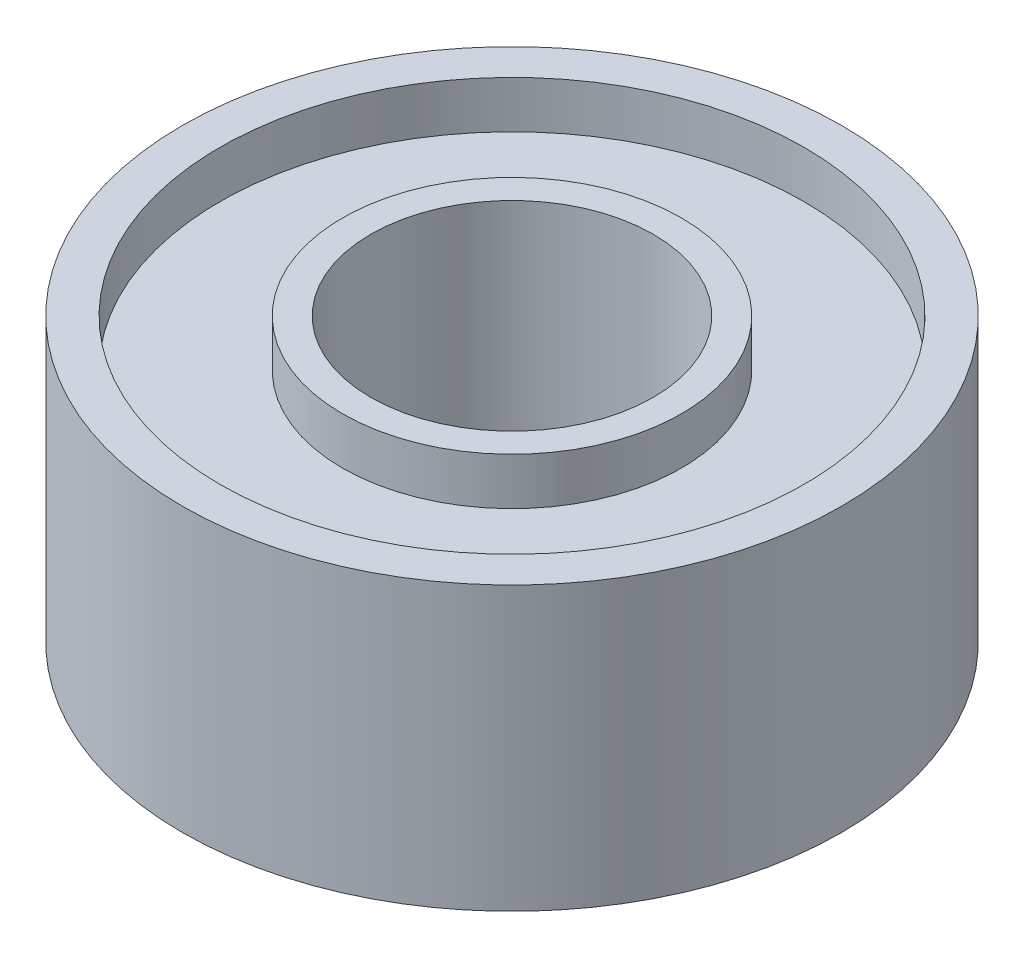
from build123d import *

# Parameters (mm, degrees)
SKETCH_1_R          = 3.5
SKETCH_1_R_2        = 1.5
EXTRUDE_1_DEPTH     = 3
SKETCH_2_R          = 3.1
SKETCH_2_R_2        = 1.8
CUT_EXTRUDE_1_DEPTH = 0.5


with BuildPart() as part:
    # 草图1 → 凸台-拉伸1 (new body)
    with BuildSketch(Plane(origin=(0, 0, 0), x_dir=(1, 0, 0), z_dir=(0, 1, 0))):
        with Locations(Location((0, 0, 0), (0, 0, 270))):
            Circle(SKETCH_1_R)
        with Locations(Location((0, 0, 0), (0, 0, 270))):
            Circle(SKETCH_1_R_2, mode=Mode.SUBTRACT)
    extrude(amount=EXTRUDE_1_DEPTH)

    # 草图2 → 切除-拉伸1 (cut)
    with BuildSketch(Plane(origin=(0, 3, 0), x_dir=(1, 0, 0), z_dir=(0, 1, 0))):
        with Locations(Location((0, 0, 0), (0, 0, 270))):
            Circle(SKETCH_2_R)
        with Locations(Location((0, 0, 0), (0, 0, 270))):
            Circle(SKETCH_2_R_2, mode=Mode.SUBTRACT)
    cut_extrude_1 = extrude(amount=-CUT_EXTRUDE_1_DEPTH, mode=Mode.SUBTRACT)

    # 镜向1: 切除-拉伸1 across plane
    add(cut_extrude_1.mirror(Plane.ZX.offset(1.5)), mode=Mode.SUBTRACT)


solid = part.part
